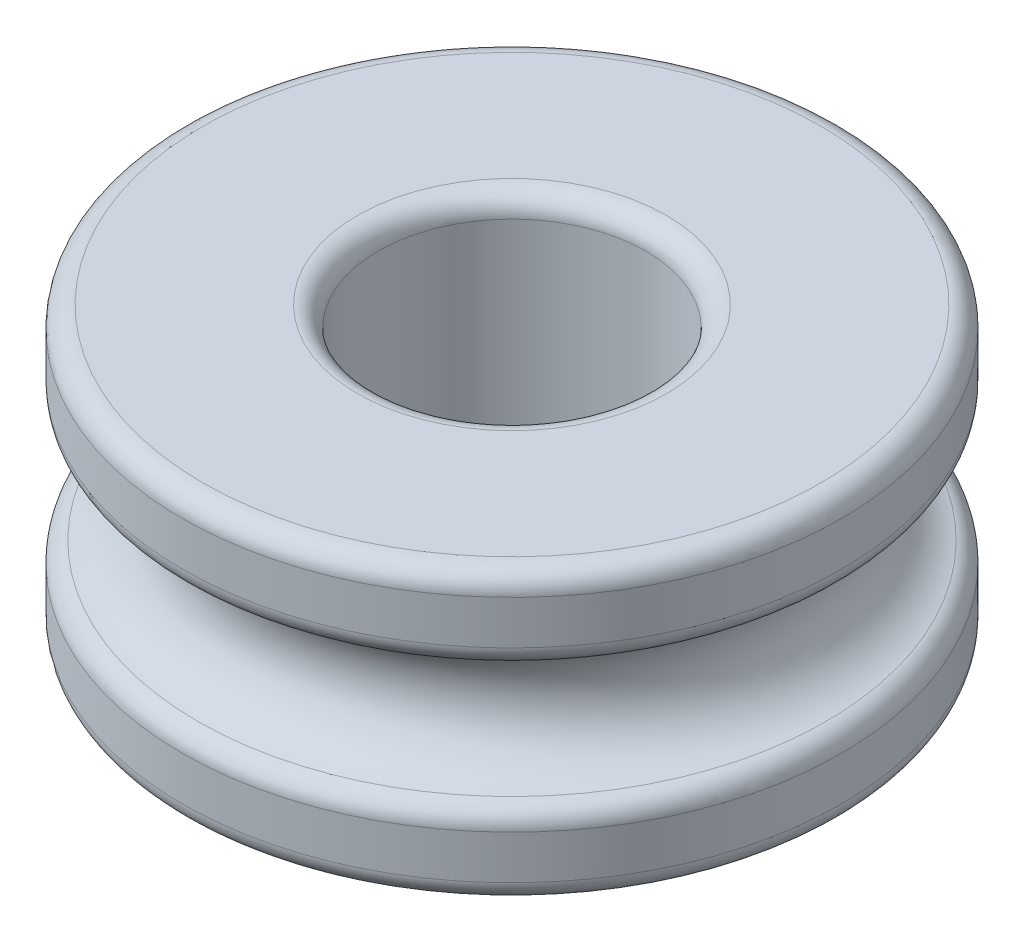
from build123d import *

# Parameters (mm, degrees)
FILLET1_R = 0.5


with BuildPart() as part:
    # Sketch1 → Revolve1 (revolve)
    with BuildSketch(Plane.XY, mode=Mode.PRIVATE) as revolve1_sk:
        with BuildLine():
            Line((1.625, 3.5), (1.625, -3.5))
            Line((1.625, -3.5), (6.375, -3.5))
            Line((6.375, -3.5), (6.375, -1.5))
            ThreePointArc((6.375, -1.5), (4.875, 0), (6.375, 1.5))
            Line((6.375, 1.5), (6.375, 3.5))
            Line((6.375, 3.5), (1.625, 3.5))
        make_face()
    revolve(revolve1_sk.sketch.rotate(Axis((-1.625, -3.5, 0), (0, 1, 0)), 90), axis=Axis((-1.625, -3.5, 0), (0, 1, 0)))

    # Fillet1
    fillet1_edges = [part.edges().sort_by_distance(p)[0] for p in [
        (-1.625, -1.5, 8),
        (-1.625, -3.5, 8),
        (-1.625, -3.5, 3.25),
        (-1.625, 3.5, 3.25),
        (-1.625, 3.5, 8),
        (-1.625, 1.5, 8),
    ]]
    fillet(fillet1_edges, radius=FILLET1_R)


solid = part.part
